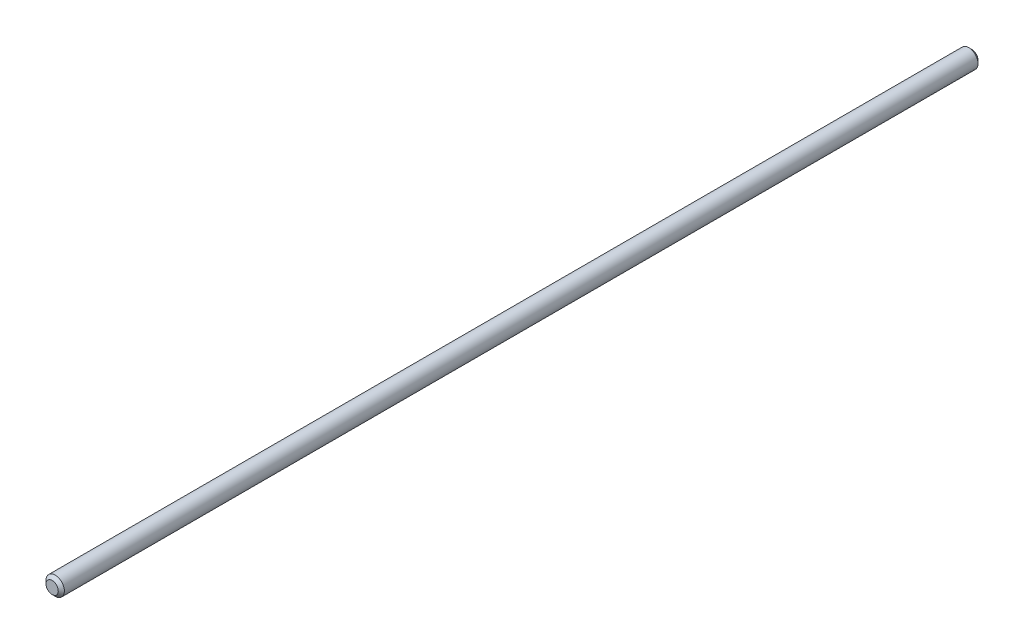
from build123d import *

# Parameters (mm, degrees)
SKETCH1_R           = 6
BOSS_EXTRUDE1_DEPTH = 600
CHAMFER1_SIZE       = 2


with BuildPart() as part:
    # Sketch1 → Boss-Extrude1 (new body)
    with BuildSketch(Plane.XY):
        Circle(SKETCH1_R)
    extrude(amount=BOSS_EXTRUDE1_DEPTH)

    # Chamfer1
    chamfer1_edges = [part.edges().sort_by_distance(p)[0] for p in [
        (-6, 0, 0),
        (-6, 0, 600),
    ]]
    chamfer(chamfer1_edges, length=CHAMFER1_SIZE)


solid = part.part
